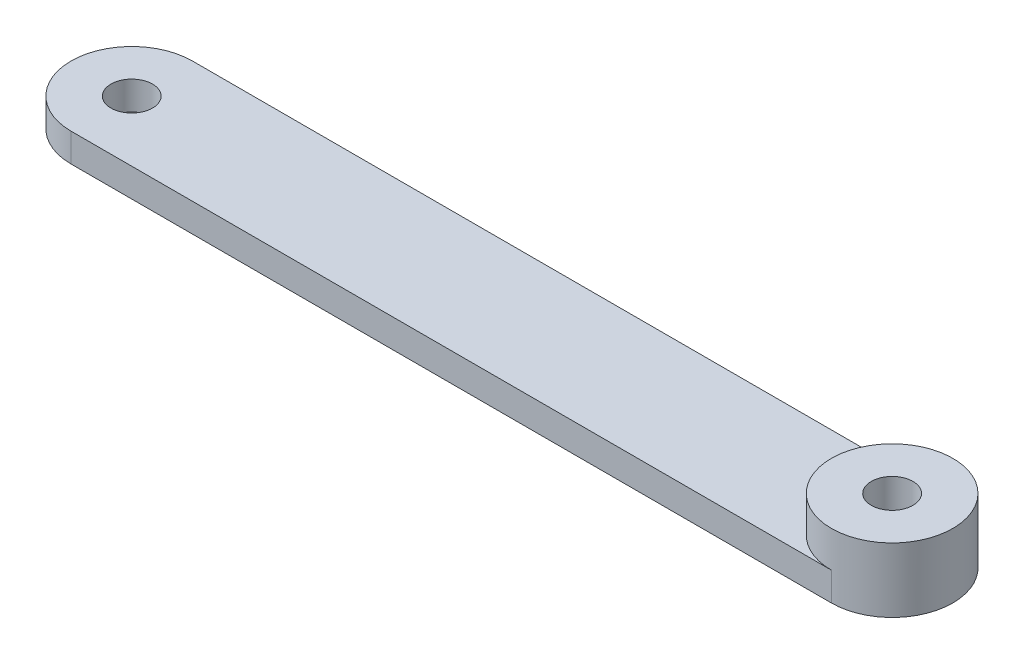
from build123d import *

# Parameters (mm, degrees)
BOSS_EXTRUDE1_DEPTH = 2.975
SKETCH2_R           = 2.175
SKETCH2_R_2         = 2.175000000000007
CUT_EXTRUDE1_DEPTH  = 12.7
SKETCH3_R           = 2.175000000000007
BOSS_EXTRUDE2_DEPTH = 3.7750000000000004


with BuildPart() as part:
    # Sketch1 → Boss-Extrude1 (new body)
    with BuildSketch(Plane(origin=(0, 0, 0), x_dir=(1, 0, 0), z_dir=(0, 1, 0))):
        with BuildLine():
            Line((-23.171929824561392, 5.625877192982455), (56.3300701754386, 5.625877192982454))
            ThreePointArc((56.3300701754386, 5.625877192982454), (62.6800701754386, -0.7241228070175446), (56.3300701754386, -7.074122807017544))
            Line((56.3300701754386, -7.074122807017544), (-23.171929824561392, -7.074122807017544))
            ThreePointArc((-23.171929824561392, -7.074122807017544), (-29.52192982456139, -0.7241228070175436), (-23.171929824561392, 5.625877192982455))
        make_face()
    extrude(amount=BOSS_EXTRUDE1_DEPTH)

    # Sketch2 → Cut-Extrude1 (cut)
    with BuildSketch(Plane(origin=(0, 2.975, 0), x_dir=(1, 0, 0), z_dir=(0, 1, 0))):
        with Locations(Location((-23.171929824561392, -0.7241228070175446, 0), (0, 0, 270))):
            Circle(SKETCH2_R)
        with Locations(Location((56.3300701754386, -0.7241228070175446, 0), (0, 0, 270))):
            Circle(SKETCH2_R_2)
    extrude(amount=-CUT_EXTRUDE1_DEPTH, mode=Mode.SUBTRACT)

    # Sketch3 → Boss-Extrude2 (add)
    with BuildSketch(Plane(origin=(0, 2.975, 0), x_dir=(1, 0, 0), z_dir=(0, 1, 0))):
        with BuildLine():
            ThreePointArc((56.3300701754386, 5.625877192982454), (62.6800701754386, -0.7241228070175451), (56.3300701754386, -7.074122807017544))
            ThreePointArc((56.3300701754386, -7.074122807017544), (49.9800701754386, -0.7241228070175443), (56.3300701754386, 5.625877192982454))
        make_face()
        with Locations(Location((56.3300701754386, -0.7241228070175446, 0), (0, 0, 270))):
            Circle(SKETCH3_R, mode=Mode.SUBTRACT)
    extrude(amount=BOSS_EXTRUDE2_DEPTH)


solid = part.part
